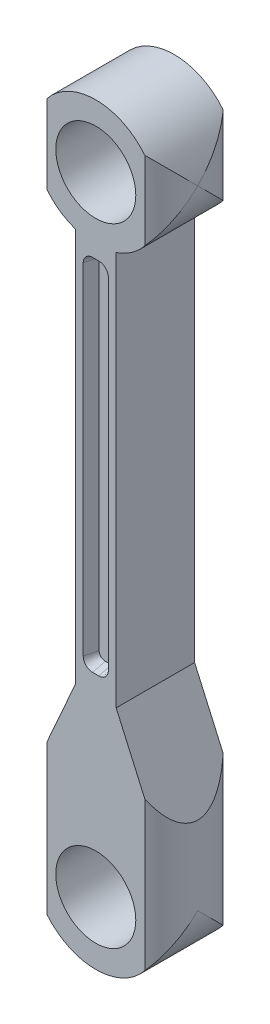
from build123d import *

# Parameters (mm, degrees)
SKETCH1_R               = 6.477
BOSS_EXTRUDE1_DEPTH     = 6.35
CUT_EXTRUDE4_START      = 6.35
CUT_EXTRUDE4_DEPTH      = 2.032
CUT_EXTRUDE4_DRAFT      = -15
MIRROR1_START           = 6.35
MIRROR1_COPY_1_DEPTH    = 2.032
MIRROR1_COPY_1_DRAFT    = -15
CUT_EXTRUDE5_DEPTH      = 113.400381227
CUT_EXTRUDE5_DEPTH_BACK = 113.400381227
SKETCH3_OUTSIDE_W       = 47.17
SKETCH3_OUTSIDE_H       = 39.55
SKETCH3_OUTSIDE_R       = 10.16


with BuildPart() as part:
    # Sketch1 → Boss-Extrude1 (new, symmetric)
    with BuildSketch(Plane.XY):
        with BuildLine():
            Line((-10.16, 0), (-10.16, 12.7))
            Line((-10.16, 12.7), (-3.302, 28.175956627))
            Line((-3.302, 28.175956627), (-3.302, 91.991545598))
            ThreePointArc((-3.302, 91.991545598), (0, 111.76), (3.302, 91.991545598))
            Line((3.302, 91.991545598), (3.302, 28.175956627))
            Line((3.302, 28.175956627), (10.16, 12.7))
            Line((10.16, 12.7), (10.16, 0))
            ThreePointArc((10.16, 0), (0, -10.16), (-10.16, 0))
        make_face()
        Circle(SKETCH1_R, mode=Mode.SUBTRACT)
        with Locations((0, 101.6)):
            Circle(SKETCH1_R, mode=Mode.SUBTRACT)
    extrude(amount=BOSS_EXTRUDE1_DEPTH, both=True)


with BuildPart() as cut_extrude4_tool:
    # Sketch2 → Cut-Extrude4 (with draft: the straight prism first)
    with BuildSketch(Plane.XY.offset(CUT_EXTRUDE4_START)):
        with BuildLine():
            ThreePointArc((0.508, 31.242), (1.585630735, 31.688369265), (2.032, 32.766))
            Line((2.032, 32.766), (2.032, 87.884))
            ThreePointArc((2.032, 87.884), (1.585630735, 88.961630735), (0.508, 89.408))
            Line((0.508, 89.408), (-0.508, 89.408))
            ThreePointArc((-0.508, 89.408), (-1.585630735, 88.961630735), (-2.032, 87.884))
            Line((-2.032, 87.884), (-2.032, 32.766))
            ThreePointArc((-2.032, 32.766), (-1.585630735, 31.688369265), (-0.508, 31.242))
            Line((-0.508, 31.242), (0.508, 31.242))
        make_face()
    extrude(amount=-CUT_EXTRUDE4_DEPTH)
    # Cut-Extrude4: the draft: its side faces are tilted about the plane it starts from
    cut_extrude4_sides = [cut_extrude4_tool.faces().sort_by_distance(p)[0] for p in [
        (-1.585630735, 31.688369265, 5.334),
        (0, 31.242, 5.334),
        (1.585630735, 31.688369265, 5.334),
        (2.032, 60.325, 5.334),
        (1.585630735, 88.961630735, 5.334),
        (0, 89.408, 5.334),
        (-1.585630735, 88.961630735, 5.334),
        (-2.032, 60.325, 5.334),
    ]]
    draft(cut_extrude4_sides, Plane.XY.offset(CUT_EXTRUDE4_START), CUT_EXTRUDE4_DRAFT)


with BuildPart() as part_1:
    add(part.part)

    # Cut-Extrude4: cut by cut_extrude4_tool
    add(cut_extrude4_tool.part, mode=Mode.SUBTRACT)


with BuildPart() as mirror1_copy_1_tool:
    # Mirror1 copy 1 sketch → Mirror1 copy 1 (with draft: the straight prism first)
    with BuildSketch(Plane(origin=(0, 0, 0), x_dir=(1, 0, 0), z_dir=(0, 0, -1)).offset(MIRROR1_START)):
        with BuildLine():
            ThreePointArc((0.508, -31.242), (1.585630735, -31.688369265), (2.032, -32.766))
            Line((2.032, -32.766), (2.032, -87.884))
            ThreePointArc((2.032, -87.884), (1.585630735, -88.961630735), (0.508, -89.408))
            Line((0.508, -89.408), (-0.508, -89.408))
            ThreePointArc((-0.508, -89.408), (-1.585630735, -88.961630735), (-2.032, -87.884))
            Line((-2.032, -87.884), (-2.032, -32.766))
            ThreePointArc((-2.032, -32.766), (-1.585630735, -31.688369265), (-0.508, -31.242))
            Line((-0.508, -31.242), (0.508, -31.242))
        make_face()
    extrude(amount=-MIRROR1_COPY_1_DEPTH)
    # Mirror1 copy 1: the draft: its side faces are tilted about the plane it starts from
    mirror1_copy_1_sides = [mirror1_copy_1_tool.faces().sort_by_distance(p)[0] for p in [
        (-1.585630735, 31.688369265, -5.334),
        (0, 31.242, -5.334),
        (1.585630735, 31.688369265, -5.334),
        (2.032, 60.325, -5.334),
        (1.585630735, 88.961630735, -5.334),
        (0, 89.408, -5.334),
        (-1.585630735, 88.961630735, -5.334),
        (-2.032, 60.325, -5.334),
    ]]
    draft(mirror1_copy_1_sides, Plane(origin=(0, 0, 0), x_dir=(1, 0, 0), z_dir=(0, 0, -1)).offset(MIRROR1_START), MIRROR1_COPY_1_DRAFT)


with BuildPart() as part_2:
    add(part_1.part)

    # Mirror1 copy 1: cut by mirror1_copy_1_tool
    add(mirror1_copy_1_tool.part, mode=Mode.SUBTRACT)

    # Sketch3 outside → Cut-Extrude5 (cut, two sides: drawn at the far end of the back side and taken through both)
    with BuildSketch(Plane(origin=(0, 0, 0), x_dir=(1, 0, 0), z_dir=(0, 1, 0)).offset(-CUT_EXTRUDE5_DEPTH_BACK)):
        Rectangle(SKETCH3_OUTSIDE_W, SKETCH3_OUTSIDE_H)
        Circle(SKETCH3_OUTSIDE_R, mode=Mode.SUBTRACT)
    extrude(amount=CUT_EXTRUDE5_DEPTH + CUT_EXTRUDE5_DEPTH_BACK, mode=Mode.SUBTRACT)


solid = part_2.part
